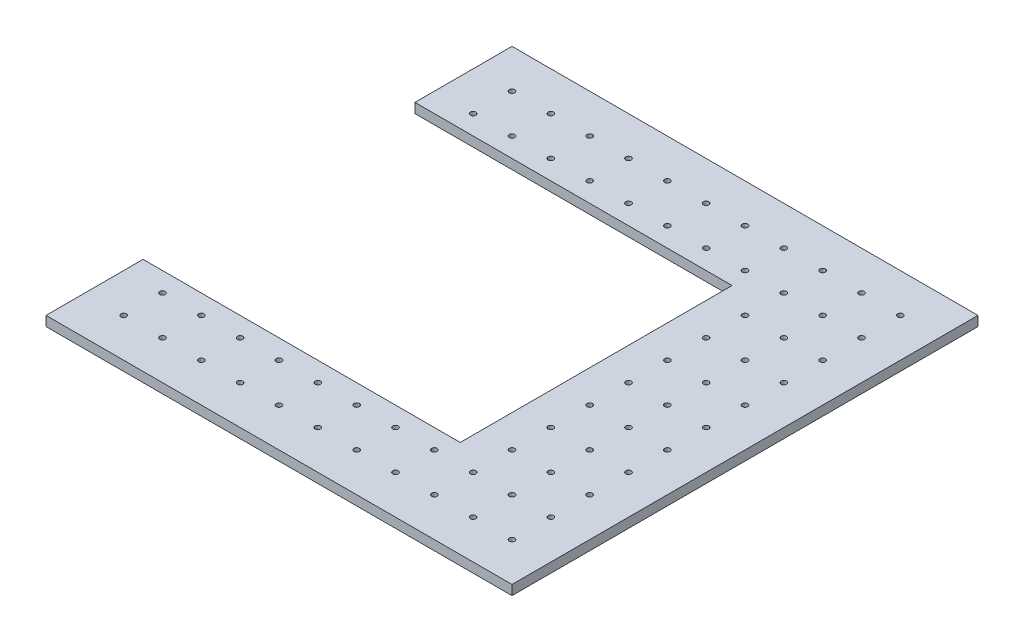
from build123d import *

# Parameters (mm, degrees)
SKETCH1_R           = 1.7907
BOSS_EXTRUDE1_DEPTH = 6.35
SKETCH2_W           = 254
SKETCH2_H           = 177.8
SKETCH2_W_2         = 311.15
SKETCH2_H_2         = 6.35
SKETCH2_W_3         = 6.35
SKETCH2_H_3         = 279.4
SKETCH2_W_4         = 279.4
CUT_EXTRUDE2_DEPTH  = 305.225337561
SKETCH3_W           = 6.35
SKETCH3_H           = 63.5
SKETCH3_H_2         = 25.4
CUT_EXTRUDE3_DEPTH  = 296.250072208


with BuildPart() as part:
    # Sketch1 → Boss-Extrude1 (new body)
    with BuildSketch(Plane(origin=(0, 0, 0), x_dir=(1, 0, 0), z_dir=(0, 1, 0))):
        Polygon((-65.292450766, -101.6), (-39.892450766, -101.6), (-39.892450766, -107.95), (-14.492450766, -107.95), (-14.492450766, -101.6), (10.907549234, -101.6), (10.907549234, -107.95), (36.307549234, -107.95), (36.307549234, -101.6), (61.707549234, -101.6), (61.707549234, -107.95), (87.107549234, -107.95), (87.107549234, -101.6), (112.507549234, -101.6), (112.507549234, -107.95), (137.907549234, -107.95), (137.907549234, -101.6), (163.307549234, -101.6), (163.307549234, -107.95), (188.707549234, -107.95), (188.707549234, -101.6), (220.457549234, -101.6), (220.457549234, -76.2), (214.107549234, -76.2), (214.107549234, -50.8), (220.457549234, -50.8), (220.457549234, -25.4), (214.107549234, -25.4), (214.107549234, 0), (220.457549234, 0), (220.457549234, 25.4), (214.107549234, 25.4), (214.107549234, 50.8), (220.457549234, 50.8), (220.457549234, 76.2), (214.107549234, 76.2), (214.107549234, 101.6), (220.457549234, 101.6), (220.457549234, 127), (214.107549234, 127), (214.107549234, 152.4), (220.457549234, 152.4), (220.457549234, 177.8), (214.107549234, 177.8), (214.107549234, 209.55), (188.707549234, 209.55), (188.707549234, 203.2), (163.307549234, 203.2), (163.307549234, 209.55), (137.907549234, 209.55), (137.907549234, 203.2), (112.507549234, 203.2), (112.507549234, 209.55), (87.107549234, 209.55), (87.107549234, 203.2), (61.707549234, 203.2), (61.707549234, 209.55), (36.307549234, 209.55), (36.307549234, 203.2), (10.907549234, 203.2), (10.907549234, 209.55), (-14.492450766, 209.55), (-14.492450766, 203.2), (-39.892450766, 203.2), (-39.892450766, 209.55), (-65.292450766, 209.55), (-65.292450766, 203.2), (-97.042450766, 203.2), (-97.042450766, 177.8), (-90.692450766, 177.8), (-90.692450766, 152.4), (-97.042450766, 152.4), (-97.042450766, 127), (-90.692450766, 127), (-90.692450766, 101.6), (-97.042450766, 101.6), (-97.042450766, 76.2), (-90.692450766, 76.2), (-90.692450766, 50.8), (-97.042450766, 50.8), (-97.042450766, 25.4), (-90.692450766, 25.4), (-90.692450766, 0), (-97.042450766, 0), (-97.042450766, -25.4), (-90.692450766, -25.4), (-90.692450766, -50.8), (-97.042450766, -50.8), (-97.042450766, -76.2), (-90.692450766, -76.2), (-90.692450766, -107.95), (-65.292450766, -107.95), align=None)
        with Locations(Location((-65.292450766, -76.2, 0), (0, 0, 270))):
            Circle(SKETCH1_R, mode=Mode.SUBTRACT)
        with Locations(Location((-39.892450766, -76.2, 0), (0, 0, 270))):
            Circle(SKETCH1_R, mode=Mode.SUBTRACT)
        with Locations(Location((-14.492450766, -76.2, 0), (0, 0, 270))):
            Circle(SKETCH1_R, mode=Mode.SUBTRACT)
        with Locations(Location((10.907549234, -76.2, 0), (0, 0, 270))):
            Circle(SKETCH1_R, mode=Mode.SUBTRACT)
        with Locations(Location((36.307549234, -76.2, 0), (0, 0, 270))):
            Circle(SKETCH1_R, mode=Mode.SUBTRACT)
        with Locations(Location((61.707549234, -76.2, 0), (0, 0, 270))):
            Circle(SKETCH1_R, mode=Mode.SUBTRACT)
        with Locations(Location((87.107549234, -76.2, 0), (0, 0, 270))):
            Circle(SKETCH1_R, mode=Mode.SUBTRACT)
        with Locations(Location((112.507549234, -76.2, 0), (0, 0, 270))):
            Circle(SKETCH1_R, mode=Mode.SUBTRACT)
        with Locations(Location((137.907549234, -76.2, 0), (0, 0, 270))):
            Circle(SKETCH1_R, mode=Mode.SUBTRACT)
        with Locations(Location((163.307549234, -76.2, 0), (0, 0, 270))):
            Circle(SKETCH1_R, mode=Mode.SUBTRACT)
        with Locations(Location((188.707549234, -76.2, 0), (0, 0, 270))):
            Circle(SKETCH1_R, mode=Mode.SUBTRACT)
        with Locations(Location((-65.292450766, -50.8, 0), (0, 0, 270))):
            Circle(SKETCH1_R, mode=Mode.SUBTRACT)
        with Locations(Location((-65.292450766, -25.4, 0), (0, 0, 270))):
            Circle(SKETCH1_R, mode=Mode.SUBTRACT)
        with Locations(Location((-65.292450766, 0, 0), (0, 0, 270))):
            Circle(SKETCH1_R, mode=Mode.SUBTRACT)
        with Locations(Location((-65.292450766, 25.4, 0), (0, 0, 270))):
            Circle(SKETCH1_R, mode=Mode.SUBTRACT)
        with Locations(Location((-65.292450766, 50.8, 0), (0, 0, 270))):
            Circle(SKETCH1_R, mode=Mode.SUBTRACT)
        with Locations(Location((-65.292450766, 76.2, 0), (0, 0, 270))):
            Circle(SKETCH1_R, mode=Mode.SUBTRACT)
        with Locations(Location((-65.292450766, 101.6, 0), (0, 0, 270))):
            Circle(SKETCH1_R, mode=Mode.SUBTRACT)
        with Locations(Location((-65.292450766, 127, 0), (0, 0, 270))):
            Circle(SKETCH1_R, mode=Mode.SUBTRACT)
        with Locations(Location((-65.292450766, 152.4, 0), (0, 0, 270))):
            Circle(SKETCH1_R, mode=Mode.SUBTRACT)
        with Locations(Location((-65.292450766, 177.8, 0), (0, 0, 270))):
            Circle(SKETCH1_R, mode=Mode.SUBTRACT)
        with Locations(Location((-39.892450766, -50.8, 0), (0, 0, 270))):
            Circle(SKETCH1_R, mode=Mode.SUBTRACT)
        with Locations(Location((-14.492450766, -50.8, 0), (0, 0, 270))):
            Circle(SKETCH1_R, mode=Mode.SUBTRACT)
        with Locations(Location((10.907549234, -50.8, 0), (0, 0, 270))):
            Circle(SKETCH1_R, mode=Mode.SUBTRACT)
        with Locations(Location((36.307549234, -50.8, 0), (0, 0, 270))):
            Circle(SKETCH1_R, mode=Mode.SUBTRACT)
        with Locations(Location((61.707549234, -50.8, 0), (0, 0, 270))):
            Circle(SKETCH1_R, mode=Mode.SUBTRACT)
        with Locations(Location((87.107549234, -50.8, 0), (0, 0, 270))):
            Circle(SKETCH1_R, mode=Mode.SUBTRACT)
        with Locations(Location((112.507549234, -50.8, 0), (0, 0, 270))):
            Circle(SKETCH1_R, mode=Mode.SUBTRACT)
        with Locations(Location((137.907549234, -50.8, 0), (0, 0, 270))):
            Circle(SKETCH1_R, mode=Mode.SUBTRACT)
        with Locations(Location((163.307549234, -50.8, 0), (0, 0, 270))):
            Circle(SKETCH1_R, mode=Mode.SUBTRACT)
        with Locations(Location((188.707549234, -50.8, 0), (0, 0, 270))):
            Circle(SKETCH1_R, mode=Mode.SUBTRACT)
        with Locations(Location((-39.892450766, -25.4, 0), (0, 0, 270))):
            Circle(SKETCH1_R, mode=Mode.SUBTRACT)
        with Locations(Location((-14.492450766, -25.4, 0), (0, 0, 270))):
            Circle(SKETCH1_R, mode=Mode.SUBTRACT)
        with Locations(Location((10.907549234, -25.4, 0), (0, 0, 270))):
            Circle(SKETCH1_R, mode=Mode.SUBTRACT)
        with Locations(Location((36.307549234, -25.4, 0), (0, 0, 270))):
            Circle(SKETCH1_R, mode=Mode.SUBTRACT)
        with Locations(Location((61.707549234, -25.4, 0), (0, 0, 270))):
            Circle(SKETCH1_R, mode=Mode.SUBTRACT)
        with Locations(Location((87.107549234, -25.4, 0), (0, 0, 270))):
            Circle(SKETCH1_R, mode=Mode.SUBTRACT)
        with Locations(Location((112.507549234, -25.4, 0), (0, 0, 270))):
            Circle(SKETCH1_R, mode=Mode.SUBTRACT)
        with Locations(Location((137.907549234, -25.4, 0), (0, 0, 270))):
            Circle(SKETCH1_R, mode=Mode.SUBTRACT)
        with Locations(Location((163.307549234, -25.4, 0), (0, 0, 270))):
            Circle(SKETCH1_R, mode=Mode.SUBTRACT)
        with Locations(Location((188.707549234, -25.4, 0), (0, 0, 270))):
            Circle(SKETCH1_R, mode=Mode.SUBTRACT)
        with Locations(Location((-39.892450766, 0, 0), (0, 0, 270))):
            Circle(SKETCH1_R, mode=Mode.SUBTRACT)
        with Locations(Location((-14.492450766, 0, 0), (0, 0, 270))):
            Circle(SKETCH1_R, mode=Mode.SUBTRACT)
        with Locations(Location((10.907549234, 0, 0), (0, 0, 270))):
            Circle(SKETCH1_R, mode=Mode.SUBTRACT)
        with Locations(Location((36.307549234, 0, 0), (0, 0, 270))):
            Circle(SKETCH1_R, mode=Mode.SUBTRACT)
        with Locations(Location((61.707549234, 0, 0), (0, 0, 270))):
            Circle(SKETCH1_R, mode=Mode.SUBTRACT)
        with Locations(Location((87.107549234, 0, 0), (0, 0, 270))):
            Circle(SKETCH1_R, mode=Mode.SUBTRACT)
        with Locations(Location((112.507549234, 0, 0), (0, 0, 270))):
            Circle(SKETCH1_R, mode=Mode.SUBTRACT)
        with Locations(Location((137.907549234, 0, 0), (0, 0, 270))):
            Circle(SKETCH1_R, mode=Mode.SUBTRACT)
        with Locations(Location((163.307549234, 0, 0), (0, 0, 270))):
            Circle(SKETCH1_R, mode=Mode.SUBTRACT)
        with Locations(Location((188.707549234, 0, 0), (0, 0, 270))):
            Circle(SKETCH1_R, mode=Mode.SUBTRACT)
        with Locations(Location((-39.892450766, 25.4, 0), (0, 0, 270))):
            Circle(SKETCH1_R, mode=Mode.SUBTRACT)
        with Locations(Location((-14.492450766, 25.4, 0), (0, 0, 270))):
            Circle(SKETCH1_R, mode=Mode.SUBTRACT)
        with Locations(Location((10.907549234, 25.4, 0), (0, 0, 270))):
            Circle(SKETCH1_R, mode=Mode.SUBTRACT)
        with Locations(Location((36.307549234, 25.4, 0), (0, 0, 270))):
            Circle(SKETCH1_R, mode=Mode.SUBTRACT)
        with Locations(Location((61.707549234, 25.4, 0), (0, 0, 270))):
            Circle(SKETCH1_R, mode=Mode.SUBTRACT)
        with Locations(Location((87.107549234, 25.4, 0), (0, 0, 270))):
            Circle(SKETCH1_R, mode=Mode.SUBTRACT)
        with Locations(Location((112.507549234, 25.4, 0), (0, 0, 270))):
            Circle(SKETCH1_R, mode=Mode.SUBTRACT)
        with Locations(Location((137.907549234, 25.4, 0), (0, 0, 270))):
            Circle(SKETCH1_R, mode=Mode.SUBTRACT)
        with Locations(Location((163.307549234, 25.4, 0), (0, 0, 270))):
            Circle(SKETCH1_R, mode=Mode.SUBTRACT)
        with Locations(Location((188.707549234, 25.4, 0), (0, 0, 270))):
            Circle(SKETCH1_R, mode=Mode.SUBTRACT)
        with Locations(Location((-39.892450766, 50.8, 0), (0, 0, 270))):
            Circle(SKETCH1_R, mode=Mode.SUBTRACT)
        with Locations(Location((-14.492450766, 50.8, 0), (0, 0, 270))):
            Circle(SKETCH1_R, mode=Mode.SUBTRACT)
        with Locations(Location((10.907549234, 50.8, 0), (0, 0, 270))):
            Circle(SKETCH1_R, mode=Mode.SUBTRACT)
        with Locations(Location((36.307549234, 50.8, 0), (0, 0, 270))):
            Circle(SKETCH1_R, mode=Mode.SUBTRACT)
        with Locations(Location((61.707549234, 50.8, 0), (0, 0, 270))):
            Circle(SKETCH1_R, mode=Mode.SUBTRACT)
        with Locations(Location((87.107549234, 50.8, 0), (0, 0, 270))):
            Circle(SKETCH1_R, mode=Mode.SUBTRACT)
        with Locations(Location((112.507549234, 50.8, 0), (0, 0, 270))):
            Circle(SKETCH1_R, mode=Mode.SUBTRACT)
        with Locations(Location((137.907549234, 50.8, 0), (0, 0, 270))):
            Circle(SKETCH1_R, mode=Mode.SUBTRACT)
        with Locations(Location((163.307549234, 50.8, 0), (0, 0, 270))):
            Circle(SKETCH1_R, mode=Mode.SUBTRACT)
        with Locations(Location((188.707549234, 50.8, 0), (0, 0, 270))):
            Circle(SKETCH1_R, mode=Mode.SUBTRACT)
        with Locations(Location((-39.892450766, 76.2, 0), (0, 0, 270))):
            Circle(SKETCH1_R, mode=Mode.SUBTRACT)
        with Locations(Location((-14.492450766, 76.2, 0), (0, 0, 270))):
            Circle(SKETCH1_R, mode=Mode.SUBTRACT)
        with Locations(Location((10.907549234, 76.2, 0), (0, 0, 270))):
            Circle(SKETCH1_R, mode=Mode.SUBTRACT)
        with Locations(Location((36.307549234, 76.2, 0), (0, 0, 270))):
            Circle(SKETCH1_R, mode=Mode.SUBTRACT)
        with Locations(Location((61.707549234, 76.2, 0), (0, 0, 270))):
            Circle(SKETCH1_R, mode=Mode.SUBTRACT)
        with Locations(Location((87.107549234, 76.2, 0), (0, 0, 270))):
            Circle(SKETCH1_R, mode=Mode.SUBTRACT)
        with Locations(Location((112.507549234, 76.2, 0), (0, 0, 270))):
            Circle(SKETCH1_R, mode=Mode.SUBTRACT)
        with Locations(Location((137.907549234, 76.2, 0), (0, 0, 270))):
            Circle(SKETCH1_R, mode=Mode.SUBTRACT)
        with Locations(Location((163.307549234, 76.2, 0), (0, 0, 270))):
            Circle(SKETCH1_R, mode=Mode.SUBTRACT)
        with Locations(Location((188.707549234, 76.2, 0), (0, 0, 270))):
            Circle(SKETCH1_R, mode=Mode.SUBTRACT)
        with Locations(Location((-39.892450766, 101.6, 0), (0, 0, 270))):
            Circle(SKETCH1_R, mode=Mode.SUBTRACT)
        with Locations(Location((-14.492450766, 101.6, 0), (0, 0, 270))):
            Circle(SKETCH1_R, mode=Mode.SUBTRACT)
        with Locations(Location((10.907549234, 101.6, 0), (0, 0, 270))):
            Circle(SKETCH1_R, mode=Mode.SUBTRACT)
        with Locations(Location((36.307549234, 101.6, 0), (0, 0, 270))):
            Circle(SKETCH1_R, mode=Mode.SUBTRACT)
        with Locations(Location((61.707549234, 101.6, 0), (0, 0, 270))):
            Circle(SKETCH1_R, mode=Mode.SUBTRACT)
        with Locations(Location((87.107549234, 101.6, 0), (0, 0, 270))):
            Circle(SKETCH1_R, mode=Mode.SUBTRACT)
        with Locations(Location((112.507549234, 101.6, 0), (0, 0, 270))):
            Circle(SKETCH1_R, mode=Mode.SUBTRACT)
        with Locations(Location((137.907549234, 101.6, 0), (0, 0, 270))):
            Circle(SKETCH1_R, mode=Mode.SUBTRACT)
        with Locations(Location((163.307549234, 101.6, 0), (0, 0, 270))):
            Circle(SKETCH1_R, mode=Mode.SUBTRACT)
        with Locations(Location((188.707549234, 101.6, 0), (0, 0, 270))):
            Circle(SKETCH1_R, mode=Mode.SUBTRACT)
        with Locations(Location((-39.892450766, 127, 0), (0, 0, 270))):
            Circle(SKETCH1_R, mode=Mode.SUBTRACT)
        with Locations(Location((-14.492450766, 127, 0), (0, 0, 270))):
            Circle(SKETCH1_R, mode=Mode.SUBTRACT)
        with Locations(Location((10.907549234, 127, 0), (0, 0, 270))):
            Circle(SKETCH1_R, mode=Mode.SUBTRACT)
        with Locations(Location((36.307549234, 127, 0), (0, 0, 270))):
            Circle(SKETCH1_R, mode=Mode.SUBTRACT)
        with Locations(Location((61.707549234, 127, 0), (0, 0, 270))):
            Circle(SKETCH1_R, mode=Mode.SUBTRACT)
        with Locations(Location((87.107549234, 127, 0), (0, 0, 270))):
            Circle(SKETCH1_R, mode=Mode.SUBTRACT)
        with Locations(Location((112.507549234, 127, 0), (0, 0, 270))):
            Circle(SKETCH1_R, mode=Mode.SUBTRACT)
        with Locations(Location((137.907549234, 127, 0), (0, 0, 270))):
            Circle(SKETCH1_R, mode=Mode.SUBTRACT)
        with Locations(Location((163.307549234, 127, 0), (0, 0, 270))):
            Circle(SKETCH1_R, mode=Mode.SUBTRACT)
        with Locations(Location((188.707549234, 127, 0), (0, 0, 270))):
            Circle(SKETCH1_R, mode=Mode.SUBTRACT)
        with Locations(Location((-39.892450766, 152.4, 0), (0, 0, 270))):
            Circle(SKETCH1_R, mode=Mode.SUBTRACT)
        with Locations(Location((-14.492450766, 152.4, 0), (0, 0, 270))):
            Circle(SKETCH1_R, mode=Mode.SUBTRACT)
        with Locations(Location((10.907549234, 152.4, 0), (0, 0, 270))):
            Circle(SKETCH1_R, mode=Mode.SUBTRACT)
        with Locations(Location((36.307549234, 152.4, 0), (0, 0, 270))):
            Circle(SKETCH1_R, mode=Mode.SUBTRACT)
        with Locations(Location((61.707549234, 152.4, 0), (0, 0, 270))):
            Circle(SKETCH1_R, mode=Mode.SUBTRACT)
        with Locations(Location((87.107549234, 152.4, 0), (0, 0, 270))):
            Circle(SKETCH1_R, mode=Mode.SUBTRACT)
        with Locations(Location((112.507549234, 152.4, 0), (0, 0, 270))):
            Circle(SKETCH1_R, mode=Mode.SUBTRACT)
        with Locations(Location((137.907549234, 152.4, 0), (0, 0, 270))):
            Circle(SKETCH1_R, mode=Mode.SUBTRACT)
        with Locations(Location((163.307549234, 152.4, 0), (0, 0, 270))):
            Circle(SKETCH1_R, mode=Mode.SUBTRACT)
        with Locations(Location((188.707549234, 152.4, 0), (0, 0, 270))):
            Circle(SKETCH1_R, mode=Mode.SUBTRACT)
        with Locations(Location((-39.892450766, 177.8, 0), (0, 0, 270))):
            Circle(SKETCH1_R, mode=Mode.SUBTRACT)
        with Locations(Location((-14.492450766, 177.8, 0), (0, 0, 270))):
            Circle(SKETCH1_R, mode=Mode.SUBTRACT)
        with Locations(Location((10.907549234, 177.8, 0), (0, 0, 270))):
            Circle(SKETCH1_R, mode=Mode.SUBTRACT)
        with Locations(Location((36.307549234, 177.8, 0), (0, 0, 270))):
            Circle(SKETCH1_R, mode=Mode.SUBTRACT)
        with Locations(Location((61.707549234, 177.8, 0), (0, 0, 270))):
            Circle(SKETCH1_R, mode=Mode.SUBTRACT)
        with Locations(Location((87.107549234, 177.8, 0), (0, 0, 270))):
            Circle(SKETCH1_R, mode=Mode.SUBTRACT)
        with Locations(Location((112.507549234, 177.8, 0), (0, 0, 270))):
            Circle(SKETCH1_R, mode=Mode.SUBTRACT)
        with Locations(Location((137.907549234, 177.8, 0), (0, 0, 270))):
            Circle(SKETCH1_R, mode=Mode.SUBTRACT)
        with Locations(Location((163.307549234, 177.8, 0), (0, 0, 270))):
            Circle(SKETCH1_R, mode=Mode.SUBTRACT)
        with Locations(Location((188.707549234, 177.8, 0), (0, 0, 270))):
            Circle(SKETCH1_R, mode=Mode.SUBTRACT)
    extrude(amount=BOSS_EXTRUDE1_DEPTH)

    # Sketch2 → Cut-Extrude2 (cut, through all)
    with BuildSketch(Plane(origin=(0, 6.35, 0), x_dir=(1, 0, 0), z_dir=(0, 1, 0))):
        with Locations((-10.249101816, 50.8)):
            Rectangle(SKETCH2_W, SKETCH2_H)
        with Locations((58.532549234, 206.375)):
            Rectangle(SKETCH2_W_2, SKETCH2_H_2)
        with Locations((217.282549234, 38.1)):
            Rectangle(SKETCH2_W_3, SKETCH2_H_3)
        with Locations((49.007549234, -104.775)):
            Rectangle(SKETCH2_W_4, SKETCH2_H_2)
    extrude(amount=-CUT_EXTRUDE2_DEPTH, mode=Mode.SUBTRACT)

    # Sketch3 → Cut-Extrude3 (cut, through all)
    with BuildSketch(Plane(origin=(0, 6.35, 0), x_dir=(1, 0, 0), z_dir=(0, 1, 0))):
        with Locations((-93.867450766, 171.45)):
            Rectangle(SKETCH3_W, SKETCH3_H)
        with Locations((-93.867450766, -63.5)):
            Rectangle(SKETCH3_W, SKETCH3_H_2)
    extrude(amount=-CUT_EXTRUDE3_DEPTH, mode=Mode.SUBTRACT)


solid = part.part
